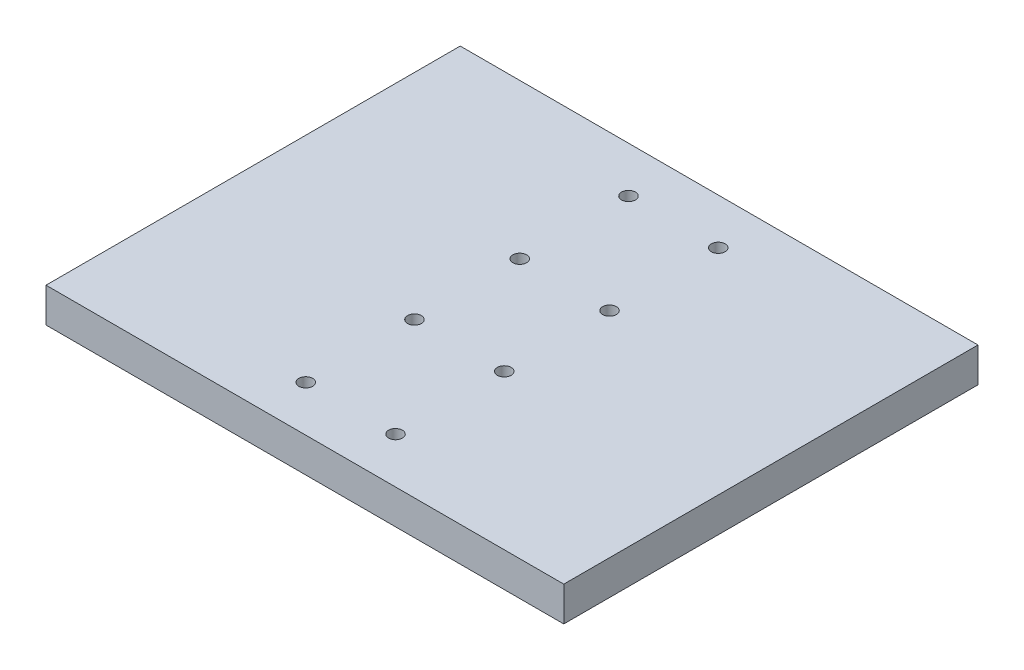
from build123d import *

# Parameters (mm, degrees)
SKETCH1_W           = 150
SKETCH1_H           = 120
SKETCH1_R           = 2
BOSS_EXTRUDE1_DEPTH = 10


with BuildPart() as part:
    # Sketch1 → Boss-Extrude1 (new body)
    with BuildSketch(Plane(origin=(0, 0, 0), x_dir=(1, 0, 0), z_dir=(0, 1, 0))):
        Rectangle(SKETCH1_W, SKETCH1_H)
        with Locations(Location((-13, 46.75, 0), (0, 0, 270))):
            Circle(SKETCH1_R, mode=Mode.SUBTRACT)
        with Locations(Location((13, 46.75, 0), (0, 0, 270))):
            Circle(SKETCH1_R, mode=Mode.SUBTRACT)
        with Locations(Location((13, 15.25, 0), (0, 0, 270))):
            Circle(SKETCH1_R, mode=Mode.SUBTRACT)
        with Locations(Location((-13, 15.25, 0), (0, 0, 270))):
            Circle(SKETCH1_R, mode=Mode.SUBTRACT)
        with Locations(Location((-13, -15.25, 0), (0, 0, 270))):
            Circle(SKETCH1_R, mode=Mode.SUBTRACT)
        with Locations(Location((13, -15.25, 0), (0, 0, 270))):
            Circle(SKETCH1_R, mode=Mode.SUBTRACT)
        with Locations(Location((13, -46.75, 0), (0, 0, 270))):
            Circle(SKETCH1_R, mode=Mode.SUBTRACT)
        with Locations(Location((-13, -46.75, 0), (0, 0, 270))):
            Circle(SKETCH1_R, mode=Mode.SUBTRACT)
    extrude(amount=BOSS_EXTRUDE1_DEPTH)


solid = part.part
